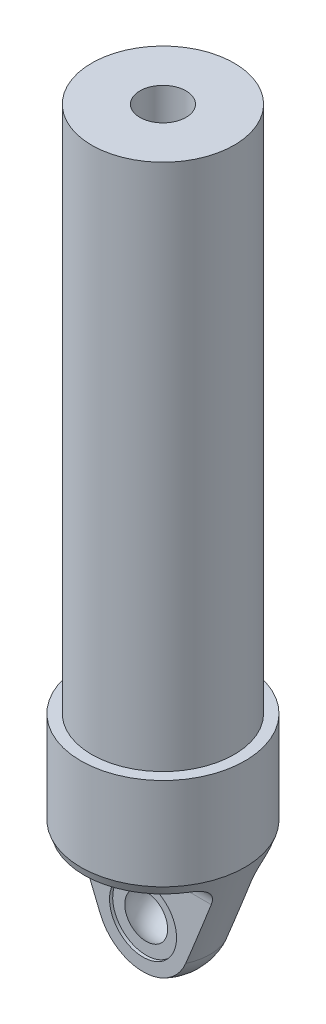
from build123d import *

# Parameters (mm, degrees)
CUT_EXTRUDE1_DEPTH = 25
CUT_EXTRUDE2_START = -4
SKETCH4_R          = 8
CUT_EXTRUDE2_DEPTH = 4
CUT_EXTRUDE3_START = 8
SKETCH4_2_R        = 8
CUT_EXTRUDE3_DEPTH = 4
SKETCH5_R          = 5.5
CUT_EXTRUDE4_DEPTH = 120


with BuildPart() as part:
    # Sketch1 → Revolve1 (revolve)
    with BuildSketch(Plane.XY):
        with BuildLine():
            Line((0, 166), (-17, 166))
            Line((-17, 166), (-17, 40))
            Line((-17, 40), (-19.6, 40))
            Line((-19.6, 40), (-19.6, 18))
            Line((-19.6, 18), (-11.23029167, -4.228539819))
            ThreePointArc((-11.23029167, -4.228539819), (-6.828525543, -9.867686604), (0, -12))
            Line((0, -12), (0, 166))
        make_face()
    revolve(axis=Axis((0, 166, 0), (0, -1, 0)))

    # Sketch2 → Cut-Extrude1 (cut, symmetric)
    with BuildSketch(Plane(origin=(0, 0, 0), x_dir=(0, 0, -1), z_dir=(1, 0, 0))):
        with BuildLine():
            Line((-4.75, -11.548161577), (-4.75, 11))
            ThreePointArc((-4.75, 11), (-6.214466094, 14.535533906), (-9.75, 16))
            Line((-9.75, 16), (-25.870257209, 16))
            Line((-25.870257209, 16), (-25.870257209, -11.548161577))
            Line((-25.870257209, -11.548161577), (-4.75, -11.548161577))
        make_face()
        with BuildLine():
            Line((25.870257209, 16), (25.870257209, -11.548161577))
            Line((25.870257209, -11.548161577), (4.75, -11.548161577))
            Line((4.75, -11.548161577), (4.75, 11))
            ThreePointArc((4.75, 11), (6.214466094, 14.535533906), (9.75, 16))
            Line((9.75, 16), (25.870257209, 16))
        make_face()
    extrude(amount=CUT_EXTRUDE1_DEPTH, both=True, mode=Mode.SUBTRACT)

    # Sketch3 → Cut-Revolve1 (revolve, cut)
    with BuildSketch(Plane.XY):
        with BuildLine():
            Line((0, -6.5), (0, 6.5))
            ThreePointArc((0, 6.5), (-6.5, 0), (0, -6.5))
        make_face()
    revolve(axis=Axis((0, -12, 0), (0, 1, 0)), mode=Mode.SUBTRACT)

    # Sketch4 → Cut-Extrude2 (cut)
    with BuildSketch(Plane.XY.offset(CUT_EXTRUDE2_START)):
        Circle(SKETCH4_R)
    extrude(amount=-CUT_EXTRUDE2_DEPTH, mode=Mode.SUBTRACT)

    # Sketch4<2> → Cut-Extrude3 (cut)
    with BuildSketch(Plane.XY.offset(CUT_EXTRUDE3_START)):
        Circle(SKETCH4_2_R)
    extrude(amount=-CUT_EXTRUDE3_DEPTH, mode=Mode.SUBTRACT)

    # Sketch5 → Cut-Extrude4 (cut)
    with BuildSketch(Plane(origin=(0, 166, 0), x_dir=(1, 0, 0), z_dir=(0, 1, 0))):
        Circle(SKETCH5_R)
    extrude(amount=-CUT_EXTRUDE4_DEPTH, mode=Mode.SUBTRACT)


solid = part.part
